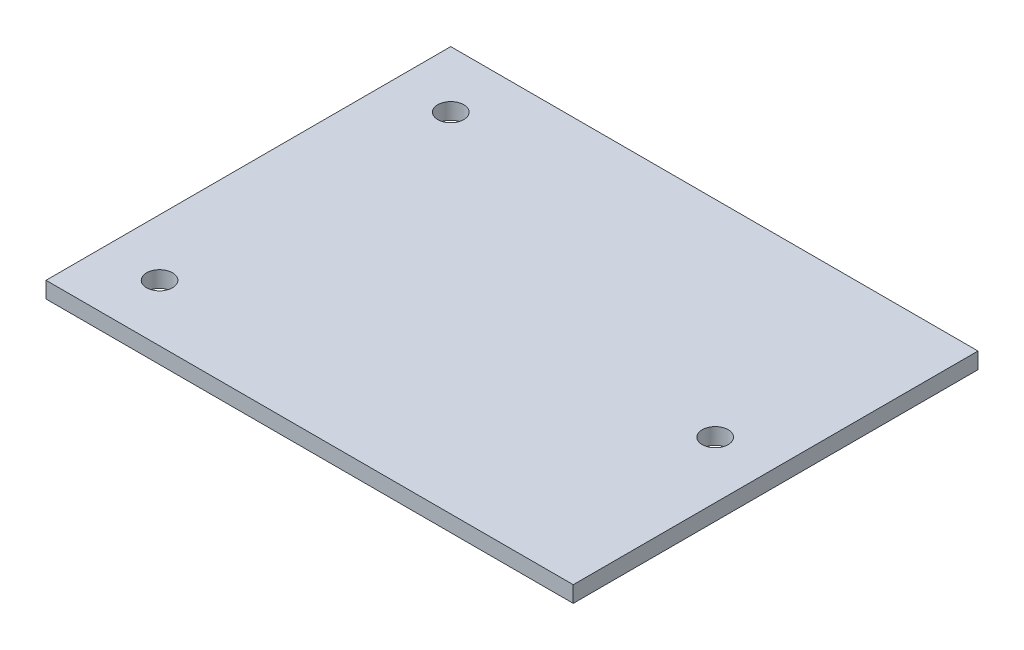
from build123d import *

# Parameters (mm, degrees)
SKETCH1_W           = 65
SKETCH1_H           = 49.9
SKETCH1_R           = 1.6
BOSS_EXTRUDE1_DEPTH = 2


with BuildPart() as part:
    # Sketch1 → Boss-Extrude1 (new body)
    with BuildSketch(Plane(origin=(0, 0, 0), x_dir=(1, 0, 0), z_dir=(0, 1, 0))):
        with Locations((5.858778736, 0)):
            Rectangle(SKETCH1_W, SKETCH1_H)
        with Locations(Location((-19.641221264, 17.95, 0), (0, 0, 270))):
            Circle(SKETCH1_R, mode=Mode.SUBTRACT)
        with Locations(Location((-19.641221264, -17.95, 0), (0, 0, 90))):
            Circle(SKETCH1_R, mode=Mode.SUBTRACT)
        with Locations(Location((31.358778736, -0.45, 0), (0, 0, 270))):
            Circle(SKETCH1_R, mode=Mode.SUBTRACT)
    extrude(amount=BOSS_EXTRUDE1_DEPTH)


solid = part.part
